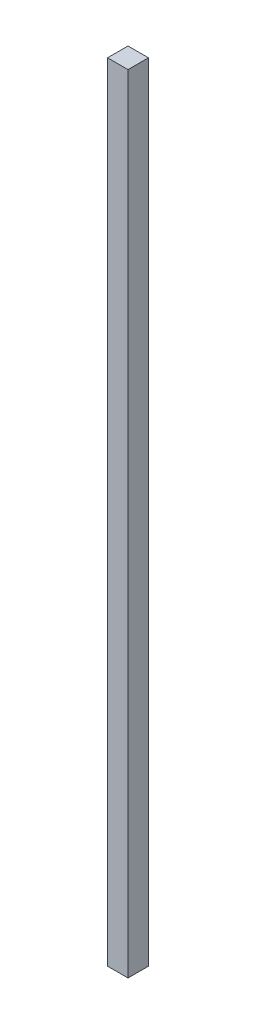
from build123d import *

# Parameters (mm, degrees)
SKETCH1_W           = 6.35
SKETCH1_H           = 6.35
BOSS_EXTRUDE1_DEPTH = 244.348


with BuildPart() as part:
    # Sketch1 → Boss-Extrude1 (new body)
    with BuildSketch(Plane(origin=(0, 0, 0), x_dir=(1, 0, 0), z_dir=(0, 1, 0))):
        with Locations((3.175, -3.175)):
            Rectangle(SKETCH1_W, SKETCH1_H)
    extrude(amount=BOSS_EXTRUDE1_DEPTH)


solid = part.part
